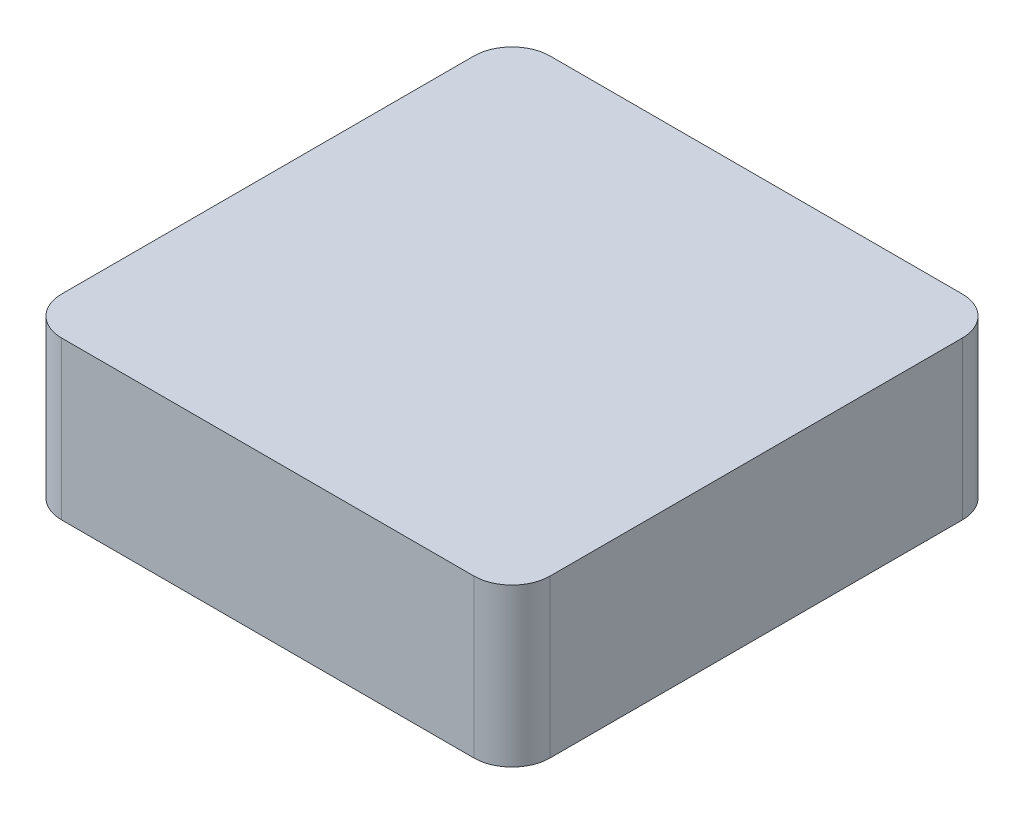
from build123d import *

# Parameters (mm, degrees)
SKETCH_1_W      = 128
SKETCH_1_H      = 128
EXTRUDE_1_DEPTH = 20.65
FILLET_1_R      = 10


with BuildPart() as part:
    # ｽｹｯﾁ1 → ﾎﾞｽ - 押し出し1 (new, symmetric)
    with BuildSketch(Plane(origin=(0, 0, 0), x_dir=(1, 0, 0), z_dir=(0, 1, 0))):
        Rectangle(SKETCH_1_W, SKETCH_1_H)
    extrude(amount=EXTRUDE_1_DEPTH, both=True)

    # ﾌｨﾚｯﾄ1
    fillet_1_edges = [part.edges().sort_by_distance(p)[0] for p in [
        (64, 0, 64),
        (-64, 0, 64),
        (-64, 0, -64),
        (64, 0, -64),
    ]]
    fillet(fillet_1_edges, radius=FILLET_1_R)


solid = part.part
